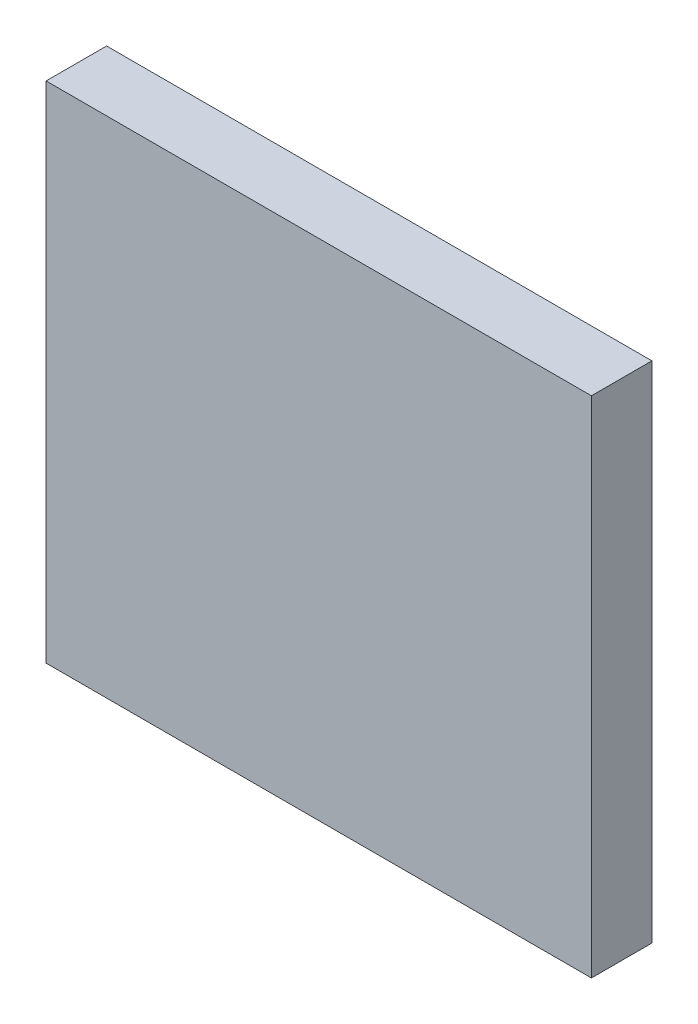
from build123d import *

# Parameters (mm, degrees)
SKETCH1_W           = 90.119835038
SKETCH1_H           = 83.330896208
BOSS_EXTRUDE1_DEPTH = 10


with BuildPart() as part:
    # Sketch1 → Boss-Extrude1 (new body)
    with BuildSketch(Plane.XY):
        Rectangle(SKETCH1_W, SKETCH1_H)
    extrude(amount=BOSS_EXTRUDE1_DEPTH)


solid = part.part
